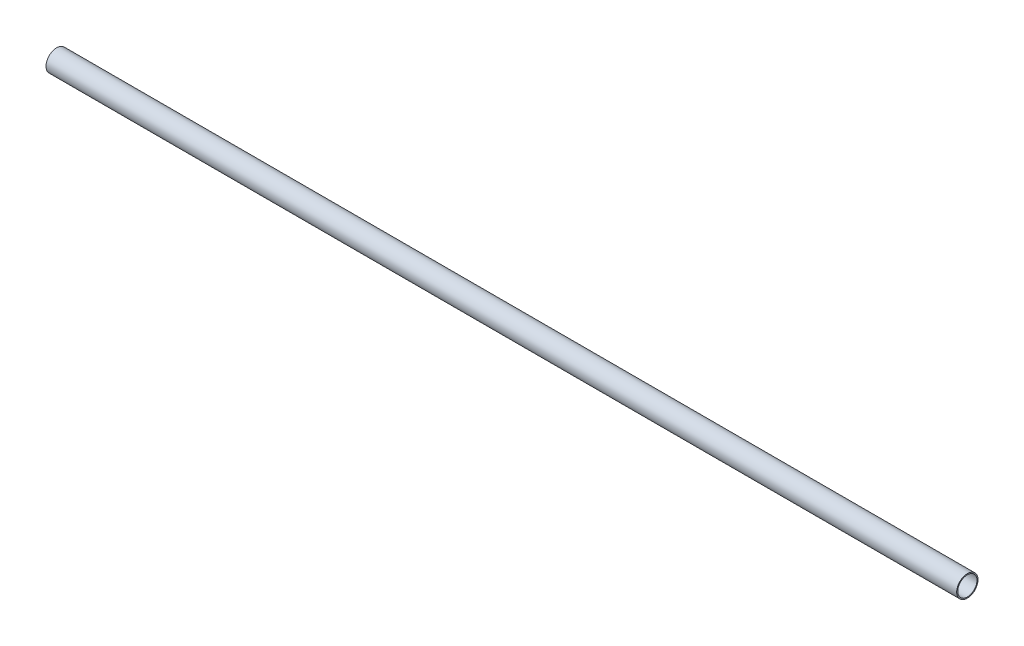
from build123d import *

# Parameters (mm, degrees)
LEG_TUBE_SKETCH_W = 1280
LEG_TUBE_SKETCH_H = 1.5


with BuildPart() as part:
    # Leg_Tube Sketch → Leg_Tube (revolve)
    with BuildSketch(Plane.XY):
        with Locations((660, 14.25)):
            Rectangle(LEG_TUBE_SKETCH_W, LEG_TUBE_SKETCH_H)
    revolve(axis=Axis((-3000, 0, 0), (1, 0, 0)))


solid = part.part
